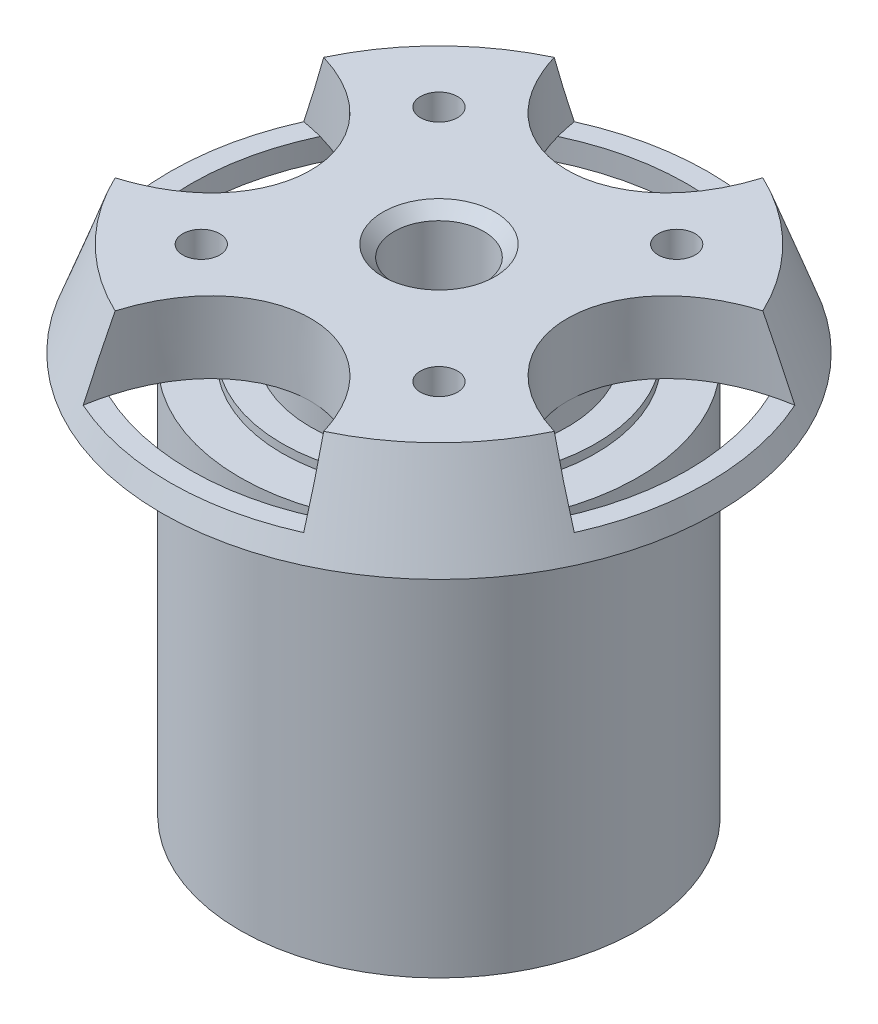
from build123d import *

# Parameters (mm, degrees)
TAP_DRILL_FOR_M4X0_7_TAP1_D     = 3.3
TAP_DRILL_FOR_M4X0_7_TAP1_DEPTH = 8
TAP_DRILL_FOR_M4X0_7_TAP1_TIP   = 0.991420021
CHAMFER1_SIZE                   = 1
CUT_EXTRUDE3_DEPTH              = 52.479971834
CIRPATTERN2_COUNT               = 4
SKETCH9_R                       = 22.15
SKETCH9_R_2                     = 11.45
CUT_EXTRUDE5_DEPTH              = 2


with BuildPart() as part:
    # Sketch2 → Revolve1 (revolve)
    with BuildSketch(Plane.XY, mode=Mode.PRIVATE) as revolve1_sk:
        Polygon((4, -44.15), (4, 0), (21.692650032, 0), (24.75, -8.4), (14, -8.4), (14, -9.15), (17.75, -9.15), (17.75, -44.15), align=None)
    revolve(revolve1_sk.sketch.rotate(Axis((0, 46.5537, 0), (0, -1, 0)), 90), axis=Axis((0, 46.5537, 0), (0, -1, 0)))

    # Tap Drill for M4x0.7 Tap1
    with Locations(Plane(origin=(0, 0, 0), x_dir=(1, 0, 0), z_dir=(0, 1, 0))):
        with Locations((10.606601718, -10.606601718), (-10.606601718, -10.606601718), (-10.606601718, 10.606601718), (10.606601718, 10.606601718)):
            Hole(TAP_DRILL_FOR_M4X0_7_TAP1_D / 2, depth=TAP_DRILL_FOR_M4X0_7_TAP1_DEPTH)
            with Locations((0, 0, -(TAP_DRILL_FOR_M4X0_7_TAP1_DEPTH + TAP_DRILL_FOR_M4X0_7_TAP1_TIP / 2))):  # 118° drill point
                Cone(0, TAP_DRILL_FOR_M4X0_7_TAP1_D / 2, TAP_DRILL_FOR_M4X0_7_TAP1_TIP, mode=Mode.SUBTRACT)

    # Chamfer1
    chamfer1_edges = [part.edges().sort_by_distance(p)[0] for p in [
        (0, 0, -4),
    ]]
    chamfer(chamfer1_edges, length=CHAMFER1_SIZE)

    # Sketch8 → Cut-Extrude3 (cut, through all)
    with BuildSketch(Plane(origin=(0, -6.4, 0), x_dir=(-1, 0, 0), z_dir=(0, -1, 0))):
        with BuildLine():
            ThreePointArc((-9.95, -22.661862236), (0, -24.75), (9.95, -22.661862236))
            add(Edge.make_bspline(
                [(-9.95, -22.661862236), (-8.05, -7.712712588), (8.05, -7.712712588), (9.95, -22.661862236)],
                knots=[0, 0, 0, 0, 1, 1, 1, 1], degree=3))
        make_face()
    cut_extrude3 = extrude(amount=-CUT_EXTRUDE3_DEPTH, mode=Mode.SUBTRACT)

    # CirPattern2: Cut-Extrude3 ×4 about axis
    cirpattern2_axis = Axis((0, 46.5537, 0), (0, -1, 0))
    for i in range(1, CIRPATTERN2_COUNT):
        add(cut_extrude3.rotate(cirpattern2_axis, i * 360 / CIRPATTERN2_COUNT), mode=Mode.SUBTRACT)

    # Sketch9 → Cut-Extrude5 (cut)
    with BuildSketch(Plane(origin=(0, -6.4, 0), x_dir=(1, 0, 0), z_dir=(0, 1, 0))):
        with Locations(Location((0, 0, 0), (0, 0, 270))):
            Circle(SKETCH9_R)
        with Locations(Location((0, 0, 0), (0, 0, 270))):
            Circle(SKETCH9_R_2, mode=Mode.SUBTRACT)
    extrude(amount=-CUT_EXTRUDE5_DEPTH, mode=Mode.SUBTRACT)


solid = part.part
